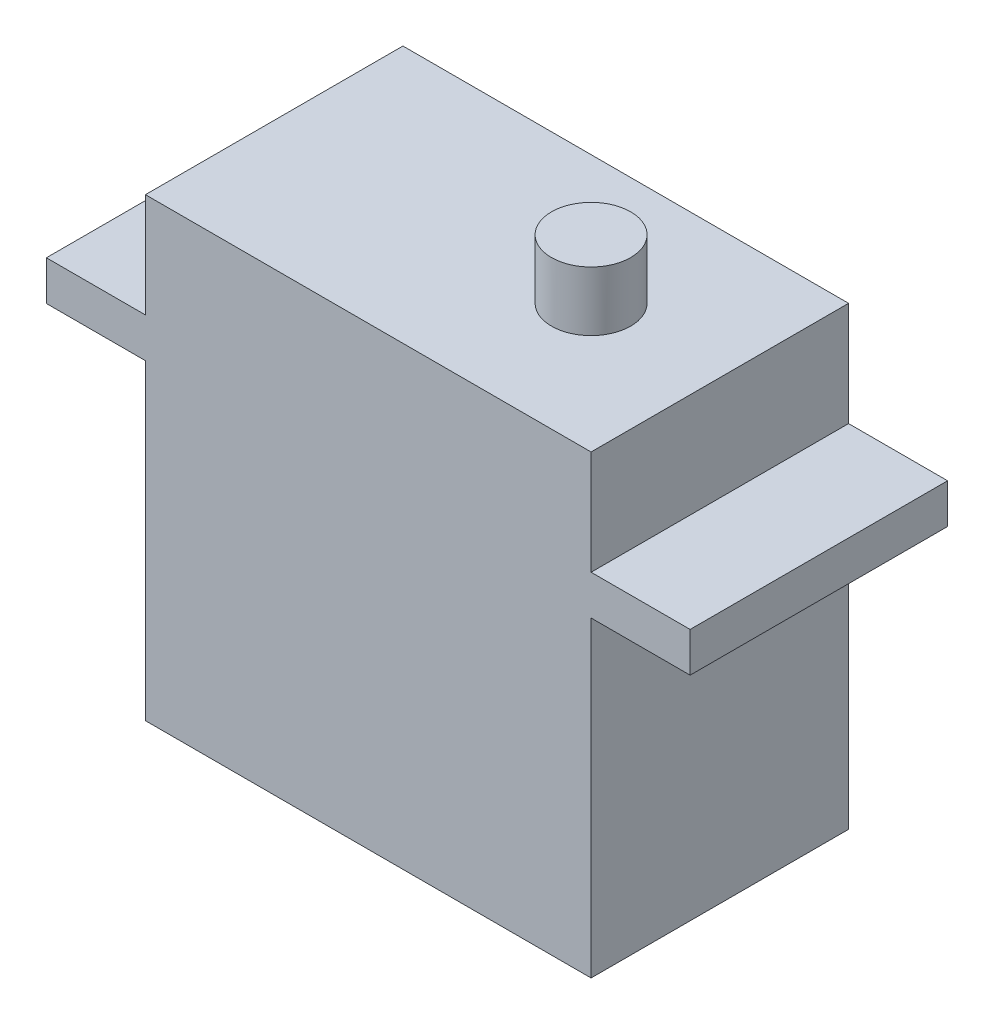
from build123d import *

# Parameters (mm, degrees)
EXTRUSION1_DEPTH = 13
ESQUISSE2_R      = 2
EXTRUSION2_DEPTH = 3


with BuildPart() as part:
    # Esquisse1 → Extrusion1 (new body)
    with BuildSketch(Plane.XY):
        Polygon((-30.903636364, 29.709316239), (-30.903636364, 24.450320542), (-35.903636364, 24.450320542), (-35.903636364, 22.450320542), (-30.903636364, 22.450320542), (-30.903636364, 6.709316239), (-8.403636364, 6.709316239), (-8.403636364, 22.450320542), (-3.403636364, 22.450320542), (-3.403636364, 24.450320542), (-8.403636364, 24.450320542), (-8.403636364, 29.709316239), align=None)
    extrude(amount=EXTRUSION1_DEPTH)

    # Esquisse2 → Extrusion2 (add)
    with BuildSketch(Plane(origin=(0, 29.709316239, 0), x_dir=(1, 0, 0), z_dir=(0, 1, 0))):
        with Locations(Location((-14.903636364, -6.5, 0), (0, 0, 90))):
            Circle(ESQUISSE2_R)
    extrude(amount=EXTRUSION2_DEPTH)


solid = part.part
